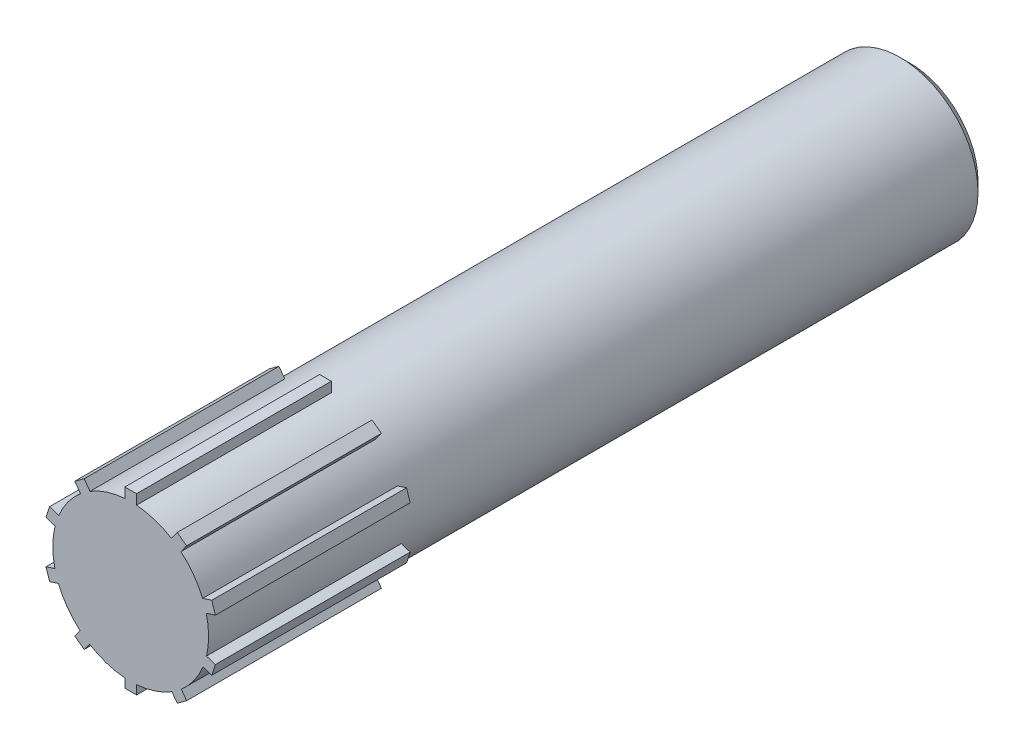
from build123d import *

# Parameters (mm, degrees)
SKETCH1_R           = 4
BOSS_EXTRUDE1_DEPTH = 40
CUT_EXTRUDE2_START  = -2.5
CUT_EXTRUDE2_DEPTH  = 38.898019753
SKETCH9_W           = 0.6
SKETCH9_H           = 2.871442339
BOSS_EXTRUDE2_DEPTH = 10
CIRPATTERN1_COUNT   = 10
CHAMFER1_SIZE       = 0.5


with BuildPart() as part:
    # Sketch1 → Boss-Extrude1 (new body)
    with BuildSketch(Plane.XY):
        Circle(SKETCH1_R)
    extrude(amount=BOSS_EXTRUDE1_DEPTH)

    # Sketch8 → Cut-Extrude2 (cut, through all)
    with BuildSketch(Plane(origin=(0, 0, 0), x_dir=(1, 0, 0), z_dir=(0, 1, 0)).offset(CUT_EXTRUDE2_START)):
        with BuildLine():
            Line((1.5, -5), (1.5, -9))
            ThreePointArc((1.5, -9), (0, -10.5), (-1.5, -9))
            Line((-1.5, -9), (-1.5, -5))
            ThreePointArc((-1.5, -5), (0, -3.5), (1.5, -5))
        make_face()
    extrude(amount=-CUT_EXTRUDE2_DEPTH, mode=Mode.SUBTRACT)

    # Sketch9 → Boss-Extrude2 (add)
    with BuildSketch(Plane.XY.offset(40)):
        with Locations((0, 3.064278831)):
            Rectangle(SKETCH9_W, SKETCH9_H)
    boss_extrude2 = extrude(amount=-BOSS_EXTRUDE2_DEPTH)

    # CirPattern1: Boss-Extrude2 ×10 about axis
    cirpattern1_axis = Axis((0, 0.025391685, 0), (0, 0, 1))
    for i in range(1, CIRPATTERN1_COUNT):
        add(boss_extrude2.rotate(cirpattern1_axis, i * 360 / CIRPATTERN1_COUNT))

    # Chamfer1
    chamfer1_edges = [part.edges().sort_by_distance(p)[0] for p in [
        (-4, 0, 0),
    ]]
    chamfer(chamfer1_edges, length=CHAMFER1_SIZE)


solid = part.part
